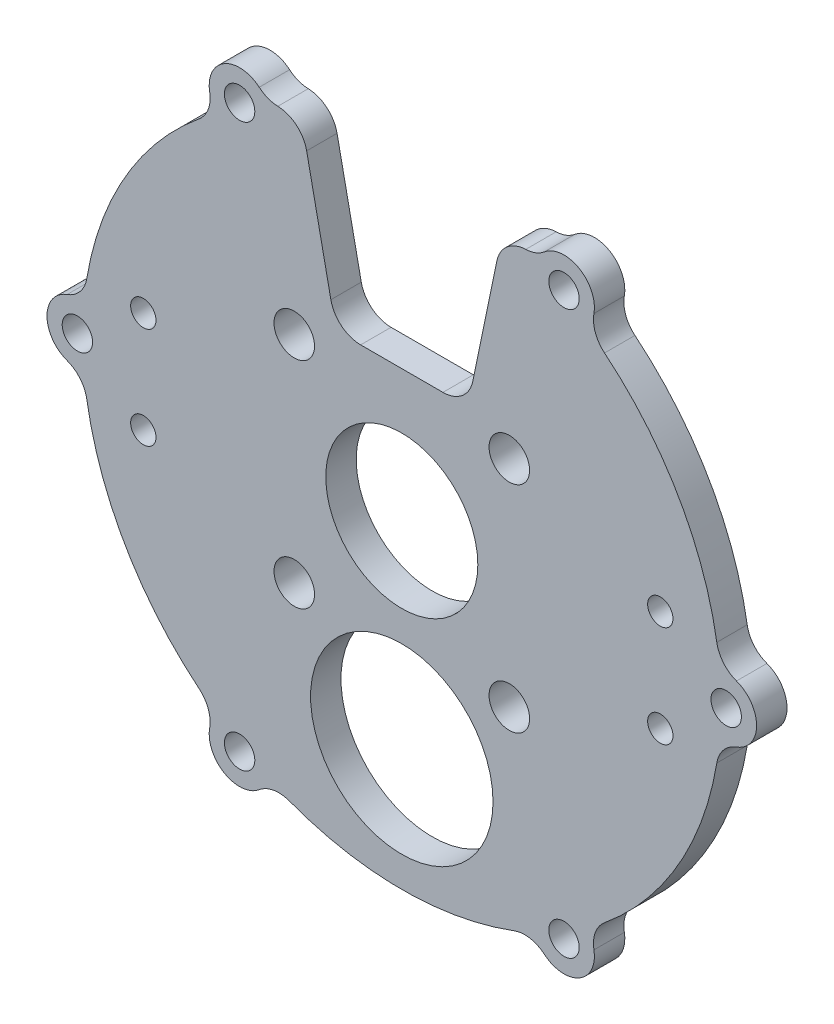
from build123d import *

# Parameters (mm, degrees)
SKETCH_1_R          = 1.9999999999999996
SKETCH_1_R_2        = 7.5
SKETCH_1_R_3        = 1.2500000000000009
SKETCH_1_R_4        = 1.5000000000000009
SKETCH_1_R_5        = 1.500000000000004
SKETCH_1_R_6        = 1.5000000000000007
EXTRUDE_1_DEPTH     = 3
SKETCH_2_R          = 9
CUT_EXTRUDE_1_DEPTH = 48.18315377335435
FILLET_1_R          = 3
FILLET_2_R          = 3


with BuildPart() as part:
    # 草图1 → 凸台-拉伸1 (new body)
    with BuildSketch(Plane.XY):
        with BuildLine():
            Line((-10, 29.87055406248769), (-6.5, 13))
            Line((-6.5, 13), (6.5, 13))
            Line((6.5, 13), (10, 29.87055406248769))
            ThreePointArc((10, 29.87055406248769), (11.588064560891594, 29.291069624249104), (13.142754663589214, 28.627224801798448))
            ThreePointArc((13.142754663589214, 28.627224801798448), (17.500000000000032, 30.310889132455387), (18.220526586410827, 25.69557181527385))
            ThreePointArc((18.220526586410827, 25.69557181527385), (27.27980021920982, 15.749999999999996), (31.36328125, 2.931652986524602))
            ThreePointArc((31.36328125, 2.931652986524602), (35.00000000000004, -1.08e-15), (31.36328125, -2.931652986524604))
            ThreePointArc((31.36328125, -2.931652986524604), (27.279800219209815, -15.75), (18.220526586410823, -25.69557181527386))
            ThreePointArc((18.220526586410823, -25.69557181527386), (17.50000000000002, -30.310889132455383), (13.142754663589177, -28.627224801798462))
            ThreePointArc((13.142754663589177, -28.627224801798462), (1.93e-15, -31.500000000000007), (-13.142754663589173, -28.62722480179847))
            ThreePointArc((-13.142754663589173, -28.62722480179847), (-17.500000000000018, -30.310889132455387), (-18.22052658641082, -25.695571815273865))
            ThreePointArc((-18.22052658641082, -25.695571815273865), (-27.279800219209815, -15.750000000000012), (-31.36328125, -2.9316529865246))
            ThreePointArc((-31.36328125, -2.9316529865246), (-35.00000000000003, 3.84e-15), (-31.36328125, 2.931652986524607))
            ThreePointArc((-31.36328125, 2.931652986524607), (-27.27980021920982, 15.75), (-18.220526586410823, 25.695571815273865))
            ThreePointArc((-18.220526586410823, 25.695571815273865), (-17.500000000000014, 30.310889132455383), (-13.142754663589173, 28.627224801798462))
            ThreePointArc((-13.142754663589173, 28.627224801798462), (-11.588064560891564, 29.29106962424911), (-10, 29.87055406248769))
        make_face()
        with Locations((-10.606601717798219, 10.606601717798215)):
            Circle(SKETCH_1_R, mode=Mode.SUBTRACT)
        with Locations((-10.606601717798215, -10.606601717798213)):
            Circle(SKETCH_1_R, mode=Mode.SUBTRACT)
        with Locations((10.606601717798211, -10.606601717798213)):
            Circle(SKETCH_1_R, mode=Mode.SUBTRACT)
        with Locations((10.606601717798204, 10.606601717798217)):
            Circle(SKETCH_1_R, mode=Mode.SUBTRACT)
        Circle(SKETCH_1_R_2, mode=Mode.SUBTRACT)
        with Locations((-25.5, 5.000000000000001)):
            Circle(SKETCH_1_R_3, mode=Mode.SUBTRACT)
        with Locations((-16, 27.71281292110204)):
            Circle(SKETCH_1_R_4, mode=Mode.SUBTRACT)
        with Locations((16.00000000000001, 27.712812921102042)):
            Circle(SKETCH_1_R_4, mode=Mode.SUBTRACT)
        with Locations((32.00000000000001, -1.08e-15)):
            Circle(SKETCH_1_R_5, mode=Mode.SUBTRACT)
        with Locations((-32, 3.47e-15)):
            Circle(SKETCH_1_R_6, mode=Mode.SUBTRACT)
        with Locations((-16, -27.712812921102046)):
            Circle(SKETCH_1_R_4, mode=Mode.SUBTRACT)
        with Locations((16.000000000000004, -27.71281292110204)):
            Circle(SKETCH_1_R_4, mode=Mode.SUBTRACT)
        with Locations((-25.5, -4.999999999999999)):
            Circle(SKETCH_1_R_3, mode=Mode.SUBTRACT)
        with Locations((25.5, -5.000000000000001)):
            Circle(SKETCH_1_R_3, mode=Mode.SUBTRACT)
        with Locations((25.5, 5.000000000000001)):
            Circle(SKETCH_1_R_3, mode=Mode.SUBTRACT)
    extrude(amount=EXTRUDE_1_DEPTH)

    # 草图2 → 切除-拉伸1 (cut, through all)
    with BuildSketch(Plane.XY.offset(3)):
        with Locations((0, -19.5)):
            Circle(SKETCH_2_R)
    extrude(amount=-CUT_EXTRUDE_1_DEPTH, mode=Mode.SUBTRACT)

    # 圆角1
    fillet_1_edges = [part.edges().sort_by_distance(p)[0] for p in [
        (13.142754663589216, 28.62722480179845, 1.5),
        (18.220526586410827, 25.69557181527385, 1.5),
        (31.36328125, 2.931652986524604, 1.5),
        (31.36328125, -2.9316529865246044, 1.5),
        (18.220526586410827, -25.69557181527386, 1.5),
        (13.142754663589178, -28.627224801798462, 1.5),
        (-13.142754663589175, -28.62722480179847, 1.5),
        (-18.22052658641082, -25.695571815273865, 1.5),
        (-31.36328125, -2.9316529865246013, 1.5),
        (-31.36328125, 2.931652986524607, 1.5),
        (-18.220526586410827, 25.695571815273862, 1.5),
        (-13.142754663589173, 28.627224801798462, 1.5),
    ]]
    fillet(fillet_1_edges, radius=FILLET_1_R)

    # 圆角2
    fillet_2_edges = [part.edges().sort_by_distance(p)[0] for p in [
        (10, 29.87055406248769, 1.5),
        (-10, 29.870554062487695, 1.5),
        (6.5, 13, 1.5),
        (-6.5, 13, 1.5),
    ]]
    fillet(fillet_2_edges, radius=FILLET_2_R)


solid = part.part
